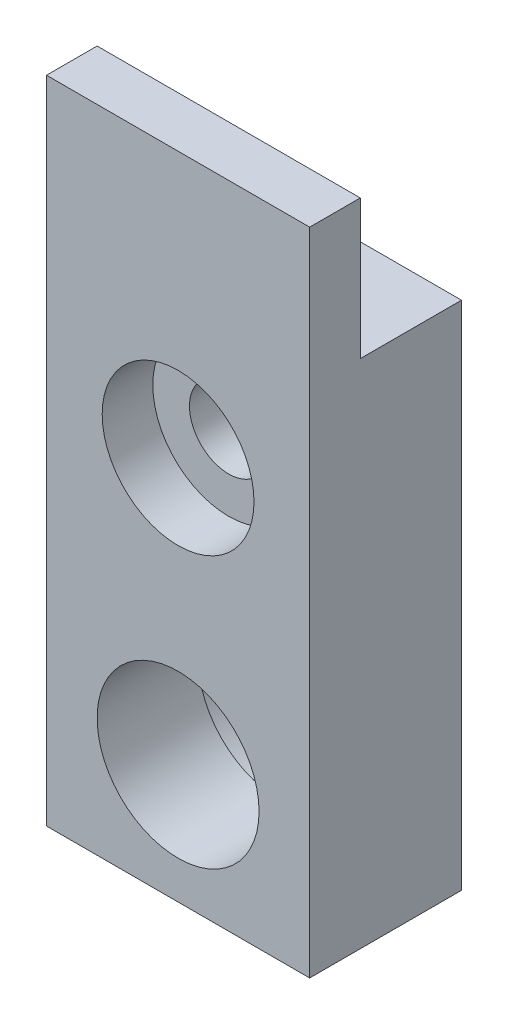
from build123d import *

# Parameters (mm, degrees)
SKETCH_1_W          = 10
SKETCH_1_H          = 25.5
EXTRUDE_1_DEPTH     = 15
SKETCH_2_R          = 1.55
CUT_EXTRUDE_1_DEPTH = 15
SKETCH_3_R          = 3
CUT_EXTRUDE_2_DEPTH = 3
SKETCH_4_R          = 3.5
CUT_EXTRUDE_3_DEPTH = 15
SKETCH_5_W          = 8
SKETCH_5_H          = 25.5
CUT_EXTRUDE_4_DEPTH = 15
SKETCH_6_R          = 4
CUT_EXTRUDE_5_DEPTH = 2
SKETCH_7_W          = 4
SKETCH_7_H          = 5.5
CUT_EXTRUDE_6_DEPTH = 15
SKETCH_8_W          = 0.2
SKETCH_8_H          = 25.5
SKETCH_8_W_2        = 10.4
SKETCH_8_H_2        = 0.2
EXTRUDE_2_DEPTH     = 7
SKETCH_9_W          = 4
SKETCH_9_H          = 5.5
CUT_EXTRUDE_7_DEPTH = 20
SKETCH_10_W         = 1
SKETCH_10_H         = 25.7
CUT_EXTRUDE_9_DEPTH = 15
SKETCH_12_R         = 3.5
SKETCH_12_R_2       = 3.2
EXTRUDE_4_DEPTH     = 4


with BuildPart() as part:
    # 草图1 → 凸台-拉伸1 (new body)
    with BuildSketch(Plane.XY):
        with Locations((-10.315219411, -7.965383481)):
            Rectangle(SKETCH_1_W, SKETCH_1_H)
    extrude(amount=EXTRUDE_1_DEPTH)

    # 草图2 → 切除-拉伸1 (cut)
    with BuildSketch(Plane.XY.offset(15)):
        with Locations((-10.315219411, -5.715383481)):
            Circle(SKETCH_2_R)
    extrude(amount=-CUT_EXTRUDE_1_DEPTH, mode=Mode.SUBTRACT)

    # 草图3 → 切除-拉伸2 (cut)
    with BuildSketch(Plane.XY.offset(15)):
        with Locations((-10.315219411, -5.715383481)):
            Circle(SKETCH_3_R)
    extrude(amount=-CUT_EXTRUDE_2_DEPTH, mode=Mode.SUBTRACT)

    # 草图4 → 切除-拉伸3 (cut)
    with BuildSketch(Plane.XY.offset(15)):
        with Locations((-10.315219411, -16.215383481)):
            Circle(SKETCH_4_R)
    extrude(amount=-CUT_EXTRUDE_3_DEPTH, mode=Mode.SUBTRACT)

    # 草图5 → 切除-拉伸4 (cut)
    with BuildSketch(Plane(origin=(-5.315219411, 0, 0), x_dir=(0, 0, -1), z_dir=(1, 0, 0))):
        with Locations((-4, -7.965383481)):
            Rectangle(SKETCH_5_W, SKETCH_5_H)
    extrude(amount=-CUT_EXTRUDE_4_DEPTH, mode=Mode.SUBTRACT)

    # 草图6 → 切除-拉伸5 (cut)
    with BuildSketch(Plane(origin=(0, 0, 8), x_dir=(-1, 0, 0), z_dir=(0, 0, -1))):
        with Locations((10.315219411, -16.215383481)):
            Circle(SKETCH_6_R)
    extrude(amount=-CUT_EXTRUDE_5_DEPTH, mode=Mode.SUBTRACT)

    # 草图7 → 切除-拉伸6 (cut)
    with BuildSketch(Plane(origin=(-5.315219411, 0, 0), x_dir=(0, 0, -1), z_dir=(1, 0, 0))):
        with Locations((-10, 2.034616519)):
            Rectangle(SKETCH_7_W, SKETCH_7_H)
    extrude(amount=-CUT_EXTRUDE_6_DEPTH, mode=Mode.SUBTRACT)

    # 草图8 → 凸台-拉伸2 (add)
    with BuildSketch(Plane.XY.offset(15)):
        with Locations((-15.415219411, -7.965383481)):
            Rectangle(SKETCH_8_W, SKETCH_8_H)
        with Locations((-5.215219411, -7.965383481)):
            Rectangle(SKETCH_8_W, SKETCH_8_H)
        with Locations((-10.315219411, -20.815383481)):
            Rectangle(SKETCH_8_W_2, SKETCH_8_H_2)
    extrude(amount=-EXTRUDE_2_DEPTH)

    # 草图9 → 切除-拉伸7 (cut)
    with BuildSketch(Plane.ZY.offset(15.515219411)):
        with Locations((10, 2.034616519)):
            Rectangle(SKETCH_9_W, SKETCH_9_H)
    extrude(amount=-CUT_EXTRUDE_7_DEPTH, mode=Mode.SUBTRACT)

    # 草图10 → 切除-拉伸9 (cut)
    with BuildSketch(Plane.ZY.offset(15.515219411)):
        with Locations((14.5, -8.065383481)):
            Rectangle(SKETCH_10_W, SKETCH_10_H)
    extrude(amount=-CUT_EXTRUDE_9_DEPTH, mode=Mode.SUBTRACT)

    # 草图12 → 凸台-拉伸4 (add)
    with BuildSketch(Plane.XY.offset(14)):
        with Locations((-10.315219411, -16.215383481)):
            Circle(SKETCH_12_R)
        with Locations((-10.315219411, -16.215383481)):
            Circle(SKETCH_12_R_2, mode=Mode.SUBTRACT)
    extrude(amount=-EXTRUDE_4_DEPTH)


solid = part.part
